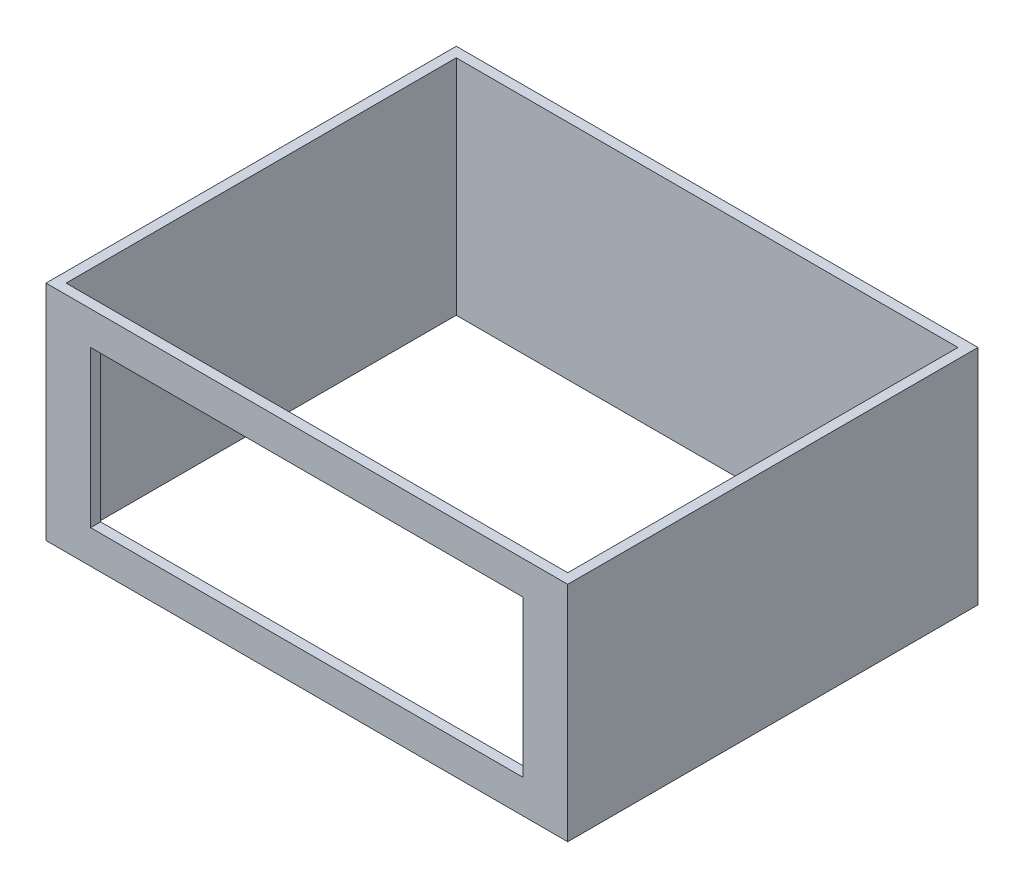
from build123d import *

# Parameters (mm, degrees)
SKETCH_1_W          = 936
SKETCH_1_H          = 736
SKETCH_1_W_2        = 900
SKETCH_1_H_2        = 700
EXTRUDE_1_DEPTH     = 400
SKETCH_2_W          = 776
SKETCH_2_H          = 280
CUT_EXTRUDE_1_DEPTH = 179


with BuildPart() as part:
    # 草图1 → 凸台-拉伸1 (new body)
    with BuildSketch(Plane(origin=(0, 0, 0), x_dir=(1, 0, 0), z_dir=(0, 1, 0))):
        with Locations((473.076923077, -350)):
            Rectangle(SKETCH_1_W, SKETCH_1_H)
        with Locations((473.076923077, -350)):
            Rectangle(SKETCH_1_W_2, SKETCH_1_H_2, mode=Mode.SUBTRACT)
    extrude(amount=EXTRUDE_1_DEPTH)

    # 草图2 → 切除-拉伸1 (cut)
    with BuildSketch(Plane.XY.offset(718)):
        with Locations((473.076923077, 200)):
            Rectangle(SKETCH_2_W, SKETCH_2_H)
    extrude(amount=-CUT_EXTRUDE_1_DEPTH, mode=Mode.SUBTRACT)


solid = part.part
